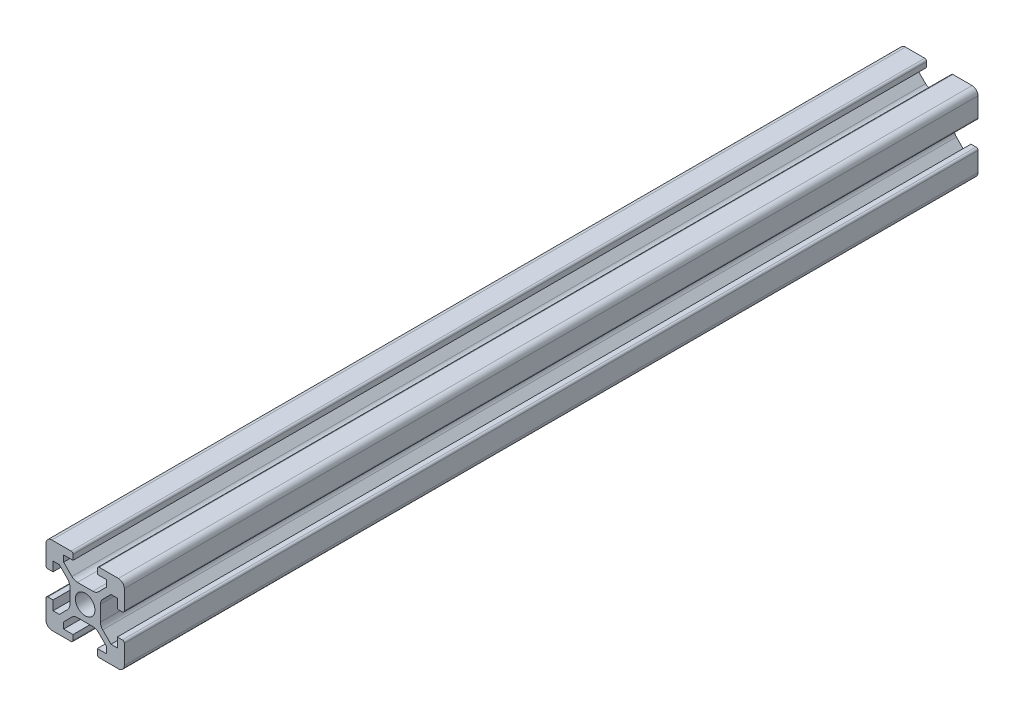
from build123d import *

# Parameters (mm, degrees)
SKETCH_1_R      = 2.5
EXTRUDE_1_DEPTH = 218


with BuildPart() as part:
    # 草图1 → 凸台-拉伸1 (new body)
    with BuildSketch(Plane.XY):
        with BuildLine():
            Line((3.9, 0), (3.9, 1.971572875))
            ThreePointArc((3.9, 1.971572875), (4.052240935, 2.73693974), (4.485786438, 3.385786438))
            Line((4.485786438, 3.385786438), (6.6, 5.5))
            Line((6.6, 5.5), (8.2, 5.5))
            Line((8.2, 5.5), (8.2, 3.1))
            Line((8.2, 3.1), (9.5, 3.1))
            ThreePointArc((9.5, 3.1), (9.853553391, 3.246446609), (10, 3.6))
            Line((10, 3.6), (10, 8.5))
            ThreePointArc((10, 8.5), (9.560660172, 9.560660172), (8.5, 10))
            Line((8.5, 10), (3.6, 10))
            ThreePointArc((3.6, 10), (3.246446609, 9.853553391), (3.1, 9.5))
            Line((3.1, 9.5), (3.1, 8.2))
            Line((3.1, 8.2), (5.5, 8.2))
            Line((5.5, 8.2), (5.5, 6.6))
            Line((5.5, 6.6), (3.385786438, 4.485786438))
            ThreePointArc((3.385786438, 4.485786438), (2.73693974, 4.052240935), (1.971572875, 3.9))
            Line((1.971572875, 3.9), (0, 3.9))
            Line((0, 3.9), (-1.971572875, 3.9))
            ThreePointArc((-1.971572875, 3.9), (-2.73693974, 4.052240935), (-3.385786438, 4.485786438))
            Line((-3.385786438, 4.485786438), (-5.5, 6.6))
            Line((-5.5, 6.6), (-5.5, 8.2))
            Line((-5.5, 8.2), (-3.1, 8.2))
            Line((-3.1, 8.2), (-3.1, 9.5))
            ThreePointArc((-3.1, 9.5), (-3.246446609, 9.853553391), (-3.6, 10))
            Line((-3.6, 10), (-8.5, 10))
            ThreePointArc((-8.5, 10), (-9.560660172, 9.560660172), (-10, 8.5))
            Line((-10, 8.5), (-10, 3.6))
            ThreePointArc((-10, 3.6), (-9.853553391, 3.246446609), (-9.5, 3.1))
            Line((-9.5, 3.1), (-8.2, 3.1))
            Line((-8.2, 3.1), (-8.2, 5.5))
            Line((-8.2, 5.5), (-6.6, 5.5))
            Line((-6.6, 5.5), (-4.485786438, 3.385786438))
            ThreePointArc((-4.485786438, 3.385786438), (-4.052240935, 2.73693974), (-3.9, 1.971572875))
            Line((-3.9, 1.971572875), (-3.9, 0))
            Line((-3.9, 0), (-3.9, -1.971572875))
            ThreePointArc((-3.9, -1.971572875), (-4.052240935, -2.73693974), (-4.485786438, -3.385786438))
            Line((-4.485786438, -3.385786438), (-6.6, -5.5))
            Line((-6.6, -5.5), (-8.2, -5.5))
            Line((-8.2, -5.5), (-8.2, -3.1))
            Line((-8.2, -3.1), (-9.5, -3.1))
            ThreePointArc((-9.5, -3.1), (-9.853553391, -3.246446609), (-10, -3.6))
            Line((-10, -3.6), (-10, -8.5))
            ThreePointArc((-10, -8.5), (-9.560660172, -9.560660172), (-8.5, -10))
            Line((-8.5, -10), (-3.6, -10))
            ThreePointArc((-3.6, -10), (-3.246446609, -9.853553391), (-3.1, -9.5))
            Line((-3.1, -9.5), (-3.1, -8.2))
            Line((-3.1, -8.2), (-5.5, -8.2))
            Line((-5.5, -8.2), (-5.5, -6.6))
            Line((-5.5, -6.6), (-3.385786438, -4.485786438))
            ThreePointArc((-3.385786438, -4.485786438), (-2.73693974, -4.052240935), (-1.971572875, -3.9))
            Line((-1.971572875, -3.9), (0, -3.9))
            Line((0, -3.9), (1.971572875, -3.9))
            ThreePointArc((1.971572875, -3.9), (2.73693974, -4.052240935), (3.385786438, -4.485786438))
            Line((3.385786438, -4.485786438), (5.5, -6.6))
            Line((5.5, -6.6), (5.5, -8.2))
            Line((5.5, -8.2), (3.1, -8.2))
            Line((3.1, -8.2), (3.1, -9.5))
            ThreePointArc((3.1, -9.5), (3.246446609, -9.853553391), (3.6, -10))
            Line((3.6, -10), (8.5, -10))
            ThreePointArc((8.5, -10), (9.560660172, -9.560660172), (10, -8.5))
            Line((10, -8.5), (10, -3.6))
            ThreePointArc((10, -3.6), (9.853553391, -3.246446609), (9.5, -3.1))
            Line((9.5, -3.1), (8.2, -3.1))
            Line((8.2, -3.1), (8.2, -5.5))
            Line((8.2, -5.5), (6.6, -5.5))
            Line((6.6, -5.5), (4.485786438, -3.385786438))
            ThreePointArc((4.485786438, -3.385786438), (4.052240935, -2.73693974), (3.9, -1.971572875))
            Line((3.9, -1.971572875), (3.9, 0))
        make_face()
        Circle(SKETCH_1_R, mode=Mode.SUBTRACT)
    extrude(amount=EXTRUDE_1_DEPTH)


solid = part.part
